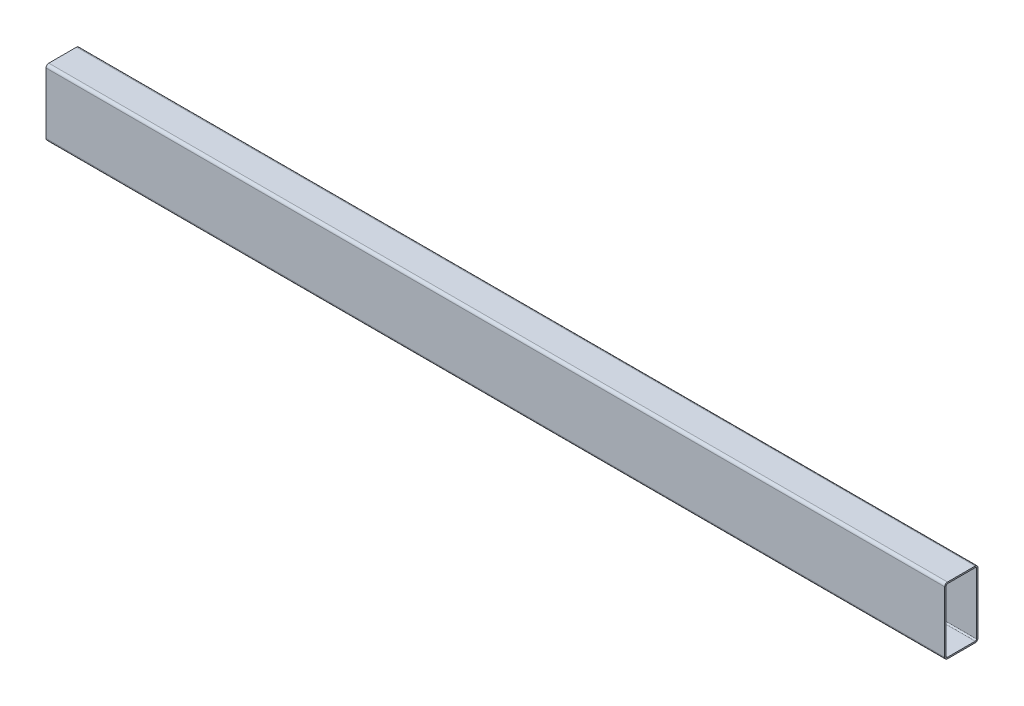
from build123d import *

# Parameters (mm, degrees)
EXTRUDE_THIN2_DEPTH = 1028.7


with BuildPart() as part:
    # Sketch1 → Extrude-Thin2 (new body)
    with BuildSketch(Plane(origin=(0, 0, 0), x_dir=(0, 0, -1), z_dir=(1, 0, 0))):
        with BuildLine():
            Line((22.252869444, 65.934166667), (-9.497130556, 65.934166667))
            ThreePointArc((-9.497130556, 65.934166667), (-11.742194586, 65.004230697), (-12.672130556, 62.759166667))
            Line((-12.672130556, 62.759166667), (-12.672130556, -7.090833333))
            ThreePointArc((-12.672130556, -7.090833333), (-11.742194586, -9.335897364), (-9.497130556, -10.265833333))
            Line((-9.497130556, -10.265833333), (22.252869444, -10.265833333))
            ThreePointArc((22.252869444, -10.265833333), (24.497933475, -9.335897364), (25.427869444, -7.090833333))
            Line((25.427869444, -7.090833333), (25.427869444, 62.759166667))
            ThreePointArc((25.427869444, 62.759166667), (24.497933475, 65.004230697), (22.252869444, 65.934166667))
        make_face()
        with BuildLine():
            Line((22.252869444, 64.283166667), (-9.497130556, 64.283166667))
            ThreePointArc((-9.497130556, 64.283166667), (-10.57476129, 63.836797401), (-11.021130556, 62.759166667))
            Line((-11.021130556, 62.759166667), (-11.021130556, -7.090833333))
            ThreePointArc((-11.021130556, -7.090833333), (-10.57476129, -8.168464068), (-9.497130556, -8.614833333))
            Line((-9.497130556, -8.614833333), (22.252869444, -8.614833333))
            ThreePointArc((22.252869444, -8.614833333), (23.330500179, -8.168464068), (23.776869444, -7.090833333))
            Line((23.776869444, -7.090833333), (23.776869444, 62.759166667))
            ThreePointArc((23.776869444, 62.759166667), (23.330500179, 63.836797401), (22.252869444, 64.283166667))
        make_face(mode=Mode.SUBTRACT)
    extrude(amount=EXTRUDE_THIN2_DEPTH)


solid = part.part
